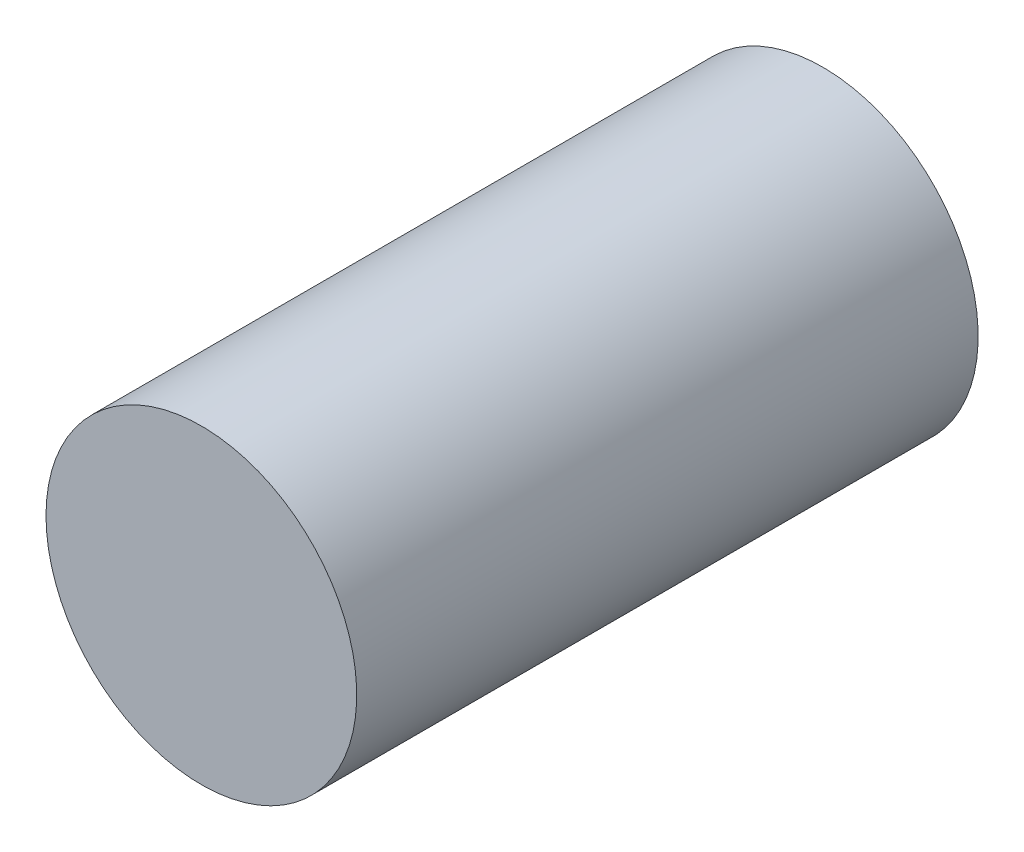
from build123d import *

# Parameters (mm, degrees)
ESQUISSE1_R        = 6.5
BOSS_EXTRU_1_DEPTH = 26


with BuildPart() as part:
    # Esquisse1 → Boss.-Extru.1 (new body)
    with BuildSketch(Plane.XY):
        with Locations(Location((0, 0, 0), (0, 0, 180))):
            Circle(ESQUISSE1_R)
    extrude(amount=BOSS_EXTRU_1_DEPTH)


solid = part.part
